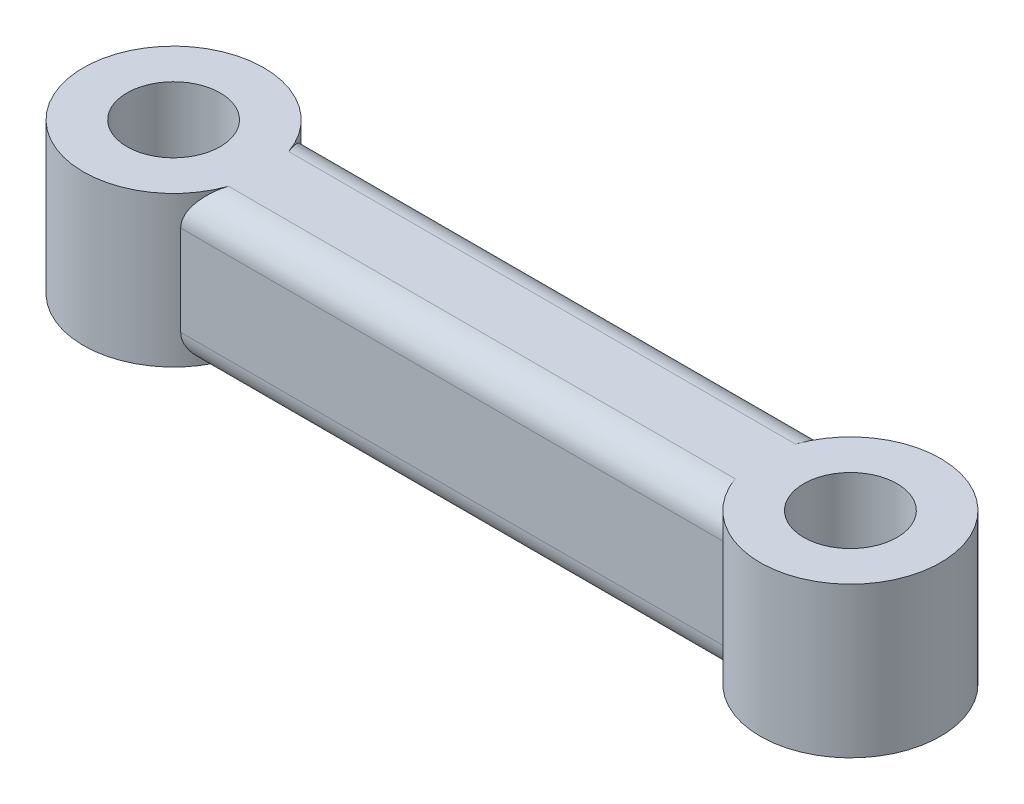
from build123d import *

# Parameters (mm, degrees)
SKETCH_1_R      = 1.55
EXTRUDE_1_DEPTH = 5
FILLET_1_R      = 1


with BuildPart() as part:
    # Эскиз1 → Бобышка-Вытянуть1 (new body)
    with BuildSketch(Plane(origin=(0, 0, 0), x_dir=(1, 0, 0), z_dir=(0, 1, 0))):
        with BuildLine():
            Line((-9.013932023, 2), (9.013932023, 2))
            ThreePointArc((9.013932023, 2), (14.25, 0), (9.013932023, -2))
            Line((9.013932023, -2), (-9.013932023, -2))
            ThreePointArc((-9.013932023, -2), (-14.25, 0), (-9.013932023, 2))
        make_face()
        with Locations(Location((-11.25, 0, 0), (0, 0, 270))):
            Circle(SKETCH_1_R, mode=Mode.SUBTRACT)
        with Locations(Location((11.25, 0, 0), (0, 0, 270))):
            Circle(SKETCH_1_R, mode=Mode.SUBTRACT)
    extrude(amount=EXTRUDE_1_DEPTH)

    # Скругление1
    fillet_1_edges = [part.edges().sort_by_distance(p)[0] for p in [
        (0, 5, -2),
        (0, 0, -2),
        (0, 0, 2),
        (0, 5, 2),
    ]]
    fillet(fillet_1_edges, radius=FILLET_1_R)


solid = part.part
